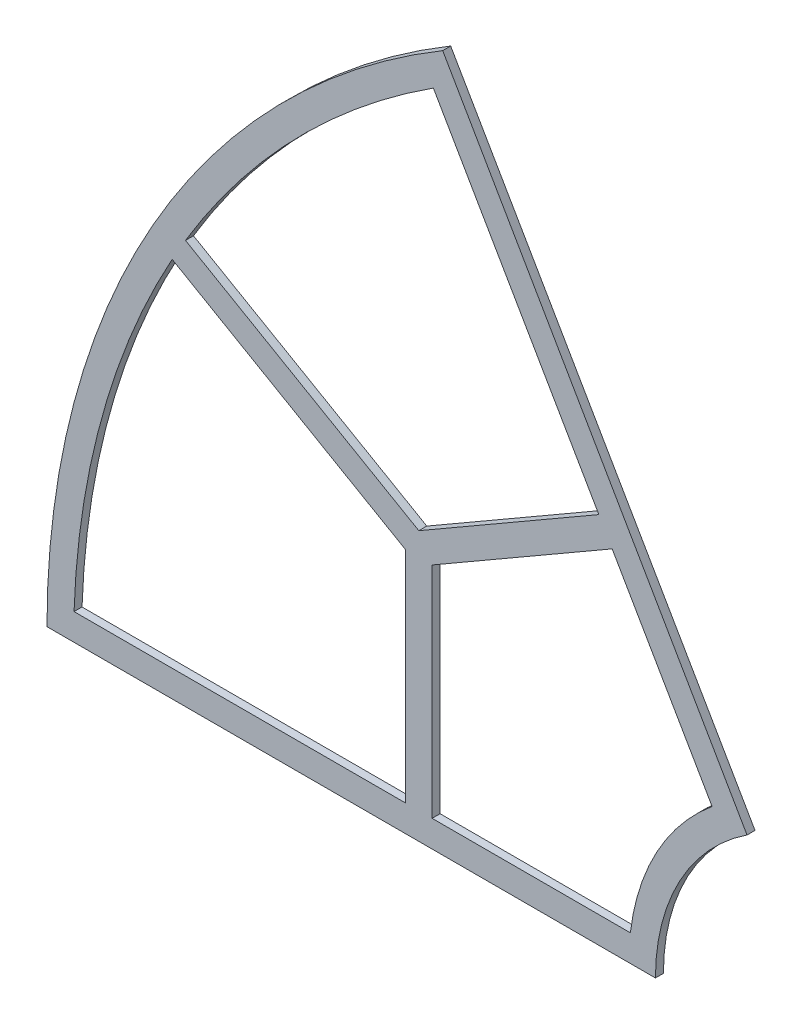
from build123d import *

# Parameters (mm, degrees)
BOSS_EXTRUDE1_DEPTH = 6


with BuildPart() as part:
    # Sketch1 → Boss-Extrude1 (new body)
    with BuildSketch(Plane.XY):
        with BuildLine():
            ThreePointArc((-83.576869021, 127.438875406), (-134.094882152, 72.417695218), (-152.4, 0))
            Line((-152.4, 0), (-609.6, 0))
            ThreePointArc((-609.6, 0), (-530.080884891, 301.042215433), (-312.269240574, 523.545682239))
            Line((-312.269240574, 523.545682239), (-83.576869021, 127.438875406))
        make_face()
        with BuildLine():
            ThreePointArc((-154.05140053, 77.394612181), (-149.302779612, 86.2), (-144.05140053, 94.715120257))
            ThreePointArc((-144.05140053, 94.715120257), (-128.363659898, 115.08488527), (-109.821022542, 132.895082707))
            Line((-109.821022542, 132.895082707), (-184.920508076, 262.971207273))
            Line((-184.920508076, 262.971207273), (-310.2, 190.641058886))
            Line((-310.2, 190.641058886), (-320.2, 184.867556195))
            Line((-320.2, 184.867556195), (-320.2, 173.320550811))
            Line((-320.2, 173.320550811), (-320.2, 20))
            Line((-320.2, 20), (-171.235977528, 20))
            ThreePointArc((-171.235977528, 20), (-165.156001883, 49.449520141), (-154.05140053, 77.394612181))
        make_face(mode=Mode.SUBTRACT)
        with BuildLine():
            Line((-340.2, 20), (-589.260689339, 20))
            ThreePointArc((-589.260689339, 20), (-568.194860877, 157.425411141), (-515.535131015, 286.097341284))
            Line((-515.535131015, 286.097341284), (-340.2, 184.867556195))
            Line((-340.2, 184.867556195), (-340.2, 20))
        make_face(mode=Mode.SUBTRACT)
        with BuildLine():
            Line((-330.2, 202.18806427), (-505.535131015, 303.41784936))
            ThreePointArc((-505.535131015, 303.41784936), (-423.458843967, 410.256952977), (-319.272010805, 495.674836073))
            Line((-319.272010805, 495.674836073), (-194.920508076, 280.291715349))
            Line((-194.920508076, 280.291715349), (-330.2, 202.18806427))
        make_face(mode=Mode.SUBTRACT)
    extrude(amount=BOSS_EXTRUDE1_DEPTH)


solid = part.part
